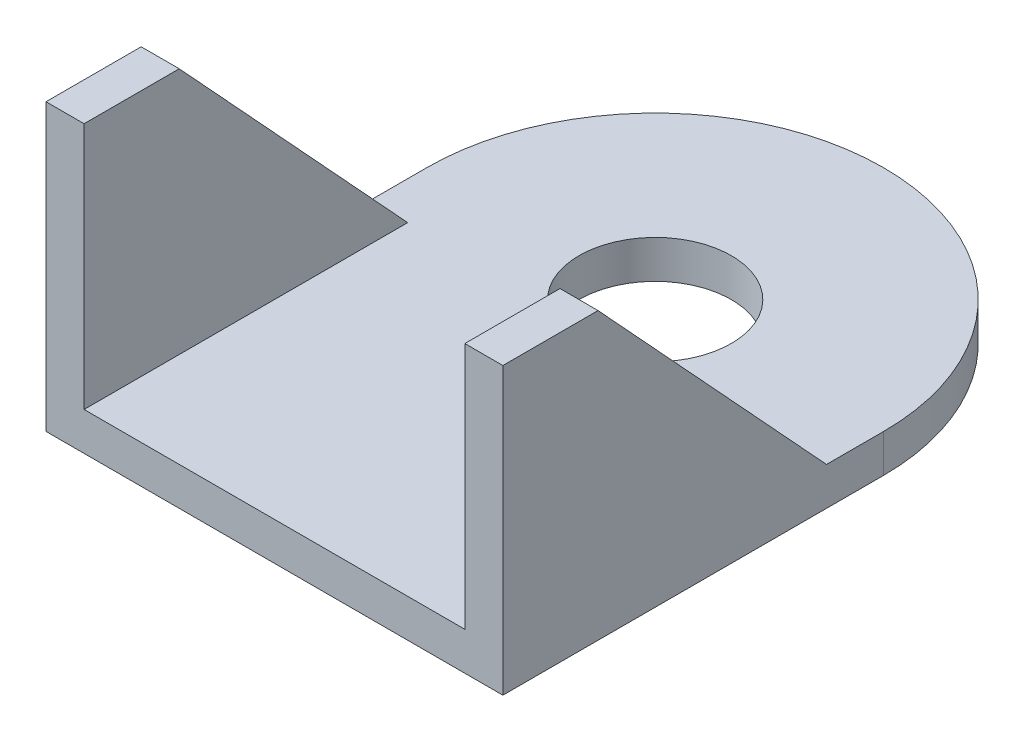
from build123d import *

# Parameters (mm, degrees)
SKETCH_1_R          = 12
SKETCH_1_R_2        = 4
EXTRUDE_1_DEPTH     = 2
EXTRUDE_2_DEPTH     = 2
BOSS_EXTRUDE1_START = -24
BOSS_EXTRUDE1_DEPTH = 2


with BuildPart() as part:
    # 草图1 → 凸台-拉伸1 (new body)
    # profile 1 of 2: a face of its own
    with BuildSketch(Plane(origin=(0, 0, 0), x_dir=(1, 0, 0), z_dir=(0, 1, 0))):
        Circle(SKETCH_1_R)
        with Locations(Location((0, 0, 0), (0, 0, 270))):
            Circle(SKETCH_1_R_2, mode=Mode.SUBTRACT)
    # profile 2 of 2: a face of its own
    with BuildSketch(Plane(origin=(0, 0, 0), x_dir=(1, 0, 0), z_dir=(0, 1, 0))):
        with BuildLine():
            ThreePointArc((12, 0), (0, -12), (-12, 0))
            Line((-12, 0), (-12, -20))
            Line((-12, -20), (12, -20))
            Line((12, -20), (12, 0))
        make_face()
    extrude(amount=EXTRUDE_1_DEPTH)

    # 草图3 → 凸台-拉伸2 (add)
    with BuildSketch(Plane(origin=(12, 0, 0), x_dir=(0, 0, -1), z_dir=(1, 0, 0))):
        Polygon((-20, 2), (-20, 15), (-15, 15), (-3, 2), align=None)
    extrude(amount=-EXTRUDE_2_DEPTH)

    # 草图3<2> → Boss-Extrude1 (add)
    with BuildSketch(Plane(origin=(12, 0, 0), x_dir=(0, 0, -1), z_dir=(1, 0, 0)).offset(BOSS_EXTRUDE1_START)):
        Polygon((-20, 2), (-20, 15), (-15, 15), (-3, 2), align=None)
    extrude(amount=BOSS_EXTRUDE1_DEPTH)


solid = part.part
